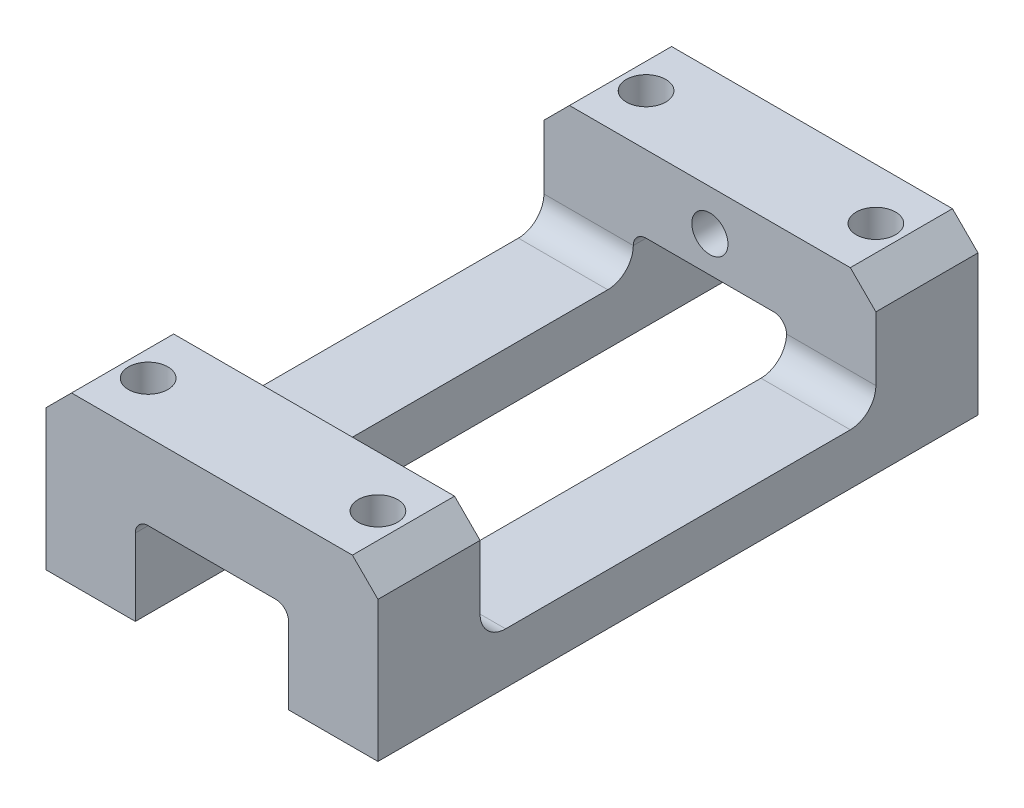
from build123d import *

# Parameters (mm, degrees)
BOSS_EXTRUDE1_DEPTH     = 149.225
CHAMFER1_SIZE           = 6.35
F_3_8_CLEARANCE_HOLE1_D = 9.8044
SKETCH4_W               = 98.425
SKETCH4_H               = 28.575
CUT_EXTRUDE1_DEPTH      = 176.460048872
FILLET1_R               = 6.35
CUT_EXTRUDE2_START      = -123.825
SKETCH5_R               = 4.500000017
CUT_EXTRUDE2_DEPTH      = 40.64


with BuildPart() as part:
    # Sketch1 → Boss-Extrude1 (new body)
    with BuildSketch(Plane.XY):
        with BuildLine():
            Line((-19.05, 0), (-19.05, 19.05))
            ThreePointArc((-19.05, 19.05), (-18.12006403, 21.29506403), (-15.875, 22.225))
            Line((-15.875, 22.225), (15.875, 22.225))
            ThreePointArc((15.875, 22.225), (18.12006403, 21.29506403), (19.05, 19.05))
            Line((19.05, 19.05), (19.05, 0))
            Line((19.05, 0), (41.275, 0))
            Line((41.275, 0), (41.275, 41.275))
            Line((41.275, 41.275), (-41.275, 41.275))
            Line((-41.275, 41.275), (-41.275, 0))
            Line((-41.275, 0), (-19.05, 0))
        make_face()
    extrude(amount=BOSS_EXTRUDE1_DEPTH)

    # Chamfer1
    chamfer1_edges = [part.edges().sort_by_distance(p)[0] for p in [
        (-41.275, 41.275, 74.6125),
        (41.275, 41.275, 74.6125),
    ]]
    chamfer(chamfer1_edges, length=CHAMFER1_SIZE)

    # 3/8 Clearance Hole1 (through all)
    with Locations(Plane(origin=(0, 41.275, 0), x_dir=(1, 0, 0), z_dir=(0, 1, 0))):
        with Locations((28.575, -12.7), (-28.575, -136.525), (-28.575, -12.7), (28.575, -136.525)):
            Hole(F_3_8_CLEARANCE_HOLE1_D / 2)

    # Sketch4 → Cut-Extrude1 (cut, through all)
    with BuildSketch(Plane.ZY.offset(41.275)):
        with Locations((74.6125, 26.9875)):
            Rectangle(SKETCH4_W, SKETCH4_H)
    extrude(amount=-CUT_EXTRUDE1_DEPTH, mode=Mode.SUBTRACT)

    # Fillet1
    fillet1_edges = [part.edges().sort_by_distance(p)[0] for p in [
        (30.1625, 12.7, 25.4),
        (30.1625, 12.7, 123.825),
        (-30.1625, 12.7, 123.825),
        (-30.1625, 12.7, 25.4),
    ]]
    fillet(fillet1_edges, radius=FILLET1_R)

    # Sketch5 → Cut-Extrude2 (cut)
    with BuildSketch(Plane.XY.offset(149.225).offset(CUT_EXTRUDE2_START)):
        with Locations((0, 31.115)):
            Circle(SKETCH5_R)
    extrude(amount=-CUT_EXTRUDE2_DEPTH, mode=Mode.SUBTRACT)


solid = part.part
